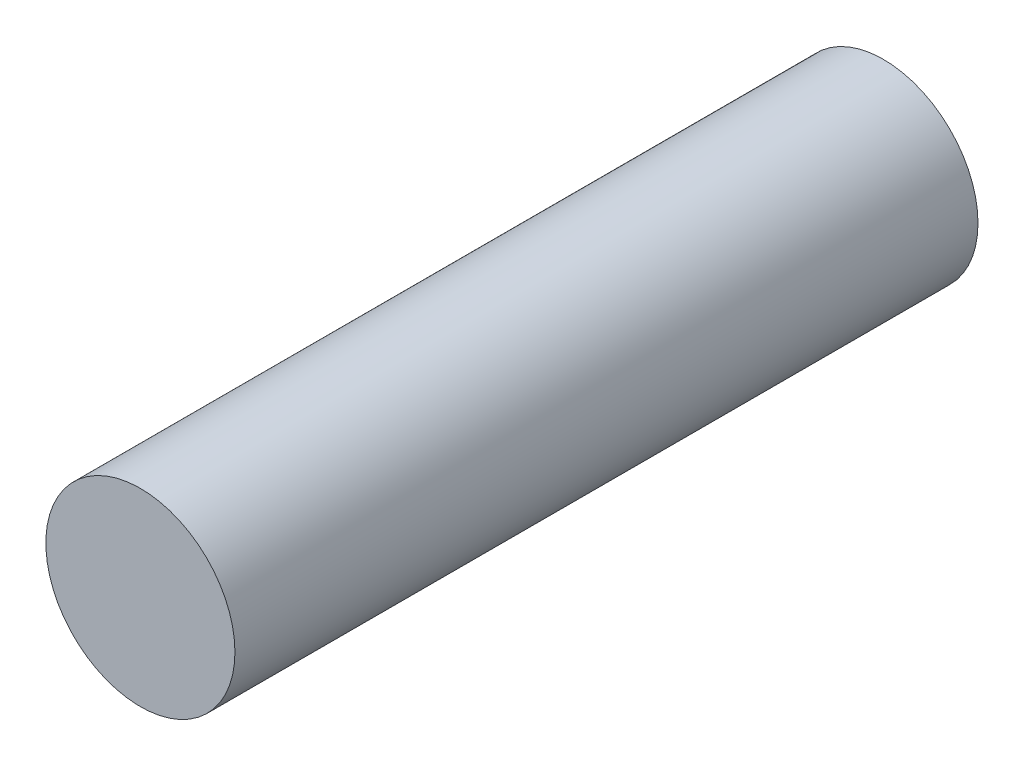
from build123d import *

# Parameters (mm, degrees)
SKETCH2_R           = 0.7
BOSS_EXTRUDE1_DEPTH = 5.501283212


with BuildPart() as part:
    # Sketch2 → Boss-Extrude1 (new body)
    with BuildSketch(Plane.XY):
        Circle(SKETCH2_R)
    extrude(amount=BOSS_EXTRUDE1_DEPTH)


solid = part.part
